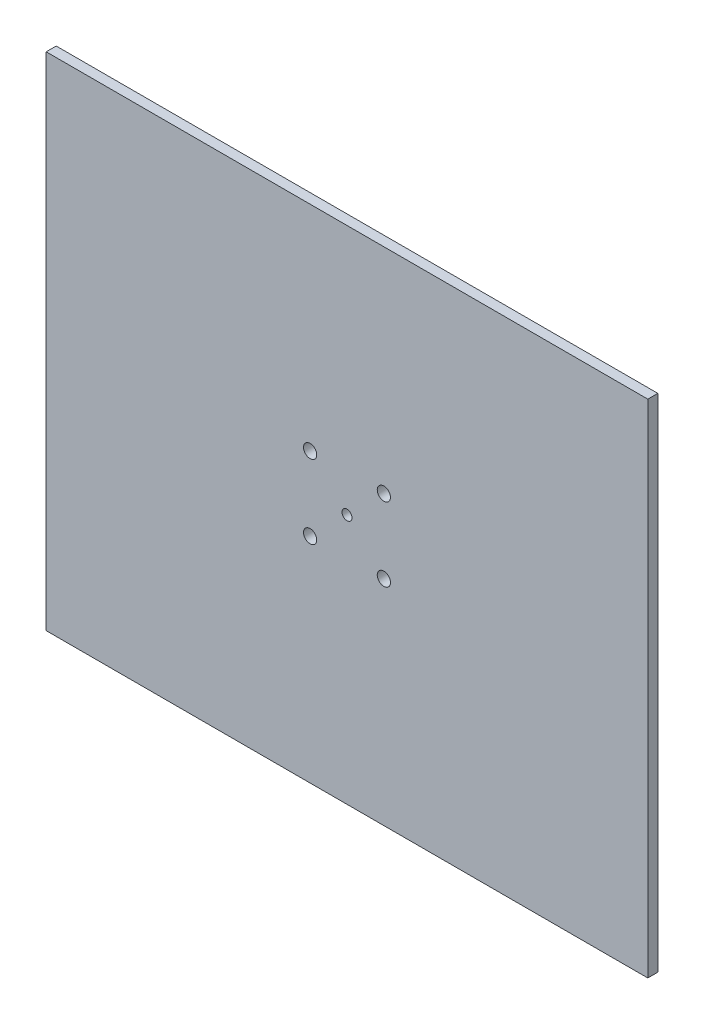
from build123d import *

# Parameters (mm, degrees)
SKETCH_1_W      = 300
SKETCH_1_H      = 250
SKETCH_1_R      = 3.3
SKETCH_1_R_2    = 2.5
EXTRUDE_1_DEPTH = 5


with BuildPart() as part:
    # 草图1 → 凸台-拉伸1 (new body)
    with BuildSketch(Plane.XY):
        Rectangle(SKETCH_1_W, SKETCH_1_H)
        with Locations((-18.384776311, 18.384776311)):
            Circle(SKETCH_1_R, mode=Mode.SUBTRACT)
        with Locations(Location((18.384776311, 18.384776311, 0), (0, 0, 180))):
            Circle(SKETCH_1_R, mode=Mode.SUBTRACT)
        with Locations((18.384776311, -18.384776311)):
            Circle(SKETCH_1_R, mode=Mode.SUBTRACT)
        with Locations(Location((-18.384776311, -18.384776311, 0), (0, 0, 180))):
            Circle(SKETCH_1_R, mode=Mode.SUBTRACT)
        Circle(SKETCH_1_R_2, mode=Mode.SUBTRACT)
    extrude(amount=EXTRUDE_1_DEPTH)


solid = part.part
